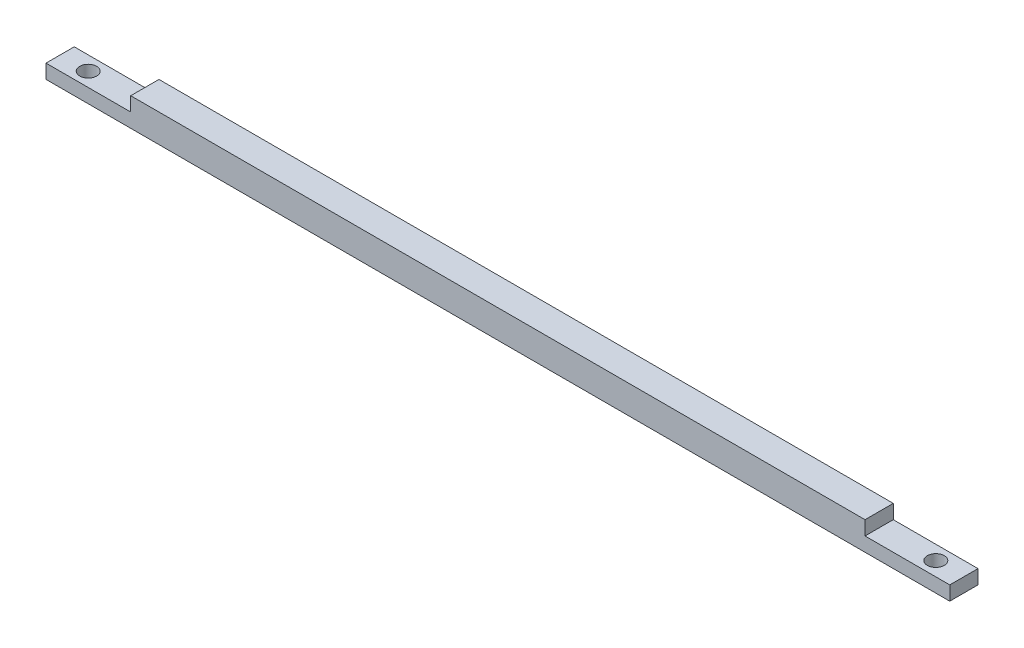
from build123d import *

# Parameters (mm, degrees)
SKETCH1_W           = 160
SKETCH1_H           = 5
BOSS_EXTRUDE1_DEPTH = 5
SKETCH2_W           = 15
SKETCH2_H           = 5
CUT_EXTRUDE1_DEPTH  = 2.5
SKETCH3_R           = 1.5
CUT_EXTRUDE2_DEPTH  = 2.5


with BuildPart() as part:
    # Sketch1 → Boss-Extrude1 (new body)
    with BuildSketch(Plane.XY):
        Rectangle(SKETCH1_W, SKETCH1_H)
    extrude(amount=BOSS_EXTRUDE1_DEPTH)

    # Sketch2 → Cut-Extrude1 (cut)
    with BuildSketch(Plane(origin=(0, 2.5, 0), x_dir=(1, 0, 0), z_dir=(0, 1, 0))):
        with Locations((-72.5, -2.5)):
            Rectangle(SKETCH2_W, SKETCH2_H)
        with Locations((72.5, -2.5)):
            Rectangle(SKETCH2_W, SKETCH2_H)
    extrude(amount=-CUT_EXTRUDE1_DEPTH, mode=Mode.SUBTRACT)

    # Sketch3 → Cut-Extrude2 (cut)
    with BuildSketch(Plane(origin=(0, 0, 0), x_dir=(1, 0, 0), z_dir=(0, 1, 0))):
        with Locations(Location((-75.030916446, -2.499854379, 0), (0, 0, 270))):
            Circle(SKETCH3_R)
        with Locations(Location((75.030916446, -2.499854379, 0), (0, 0, 90))):
            Circle(SKETCH3_R)
    extrude(amount=-CUT_EXTRUDE2_DEPTH, mode=Mode.SUBTRACT)


solid = part.part
